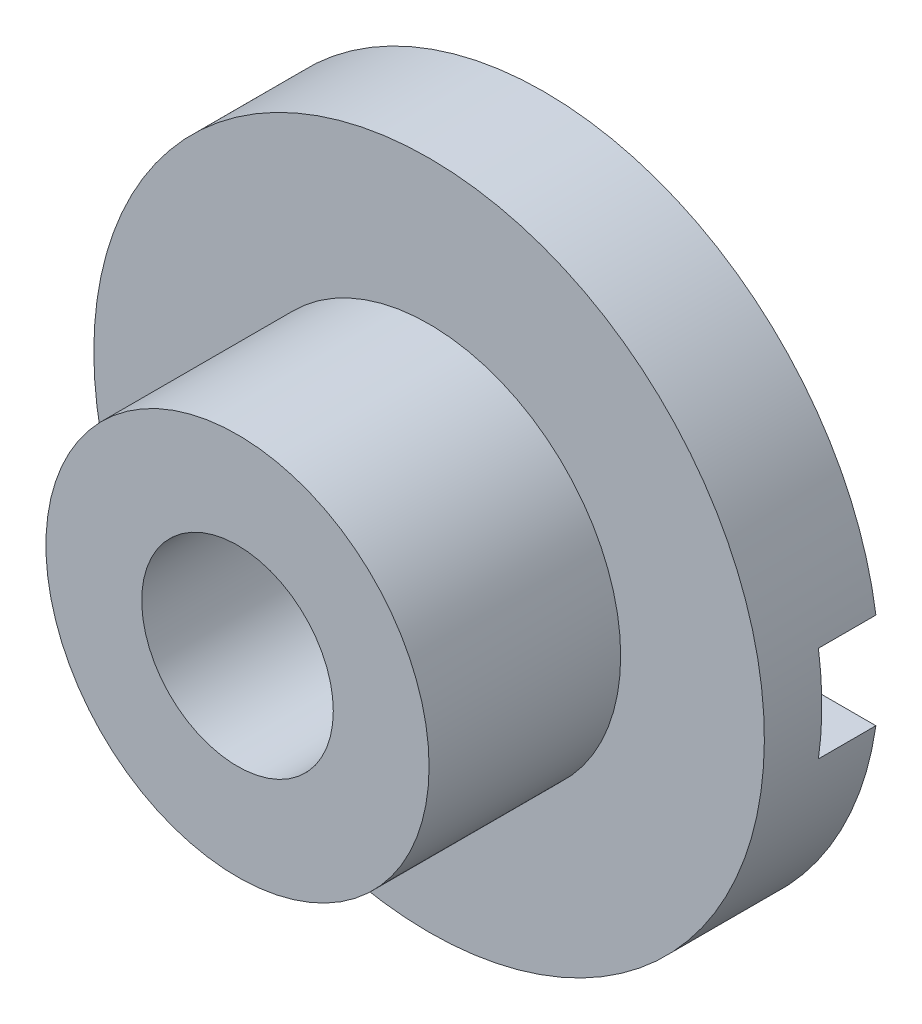
from build123d import *

# Parameters (mm, degrees)
SKETCH1_R           = 7
SKETCH1_R_2         = 3.5
BOSS_EXTRUDE1_DEPTH = 7
SKETCH2_R           = 12.25
BOSS_EXTRUDE2_DEPTH = 4.2
CUT_EXTRUDE1_START  = -2.1
CUT_EXTRUDE1_DEPTH  = 2.1
CUT_EXTRUDE2_START  = -2.1
SKETCH4_R           = 3.5
CUT_EXTRUDE2_DEPTH  = 2.1


with BuildPart() as part:
    # Sketch1 → Boss-Extrude1 (new body)
    with BuildSketch(Plane.XY):
        Circle(SKETCH1_R)
        Circle(SKETCH1_R_2, mode=Mode.SUBTRACT)
    extrude(amount=BOSS_EXTRUDE1_DEPTH)

    # Sketch2 → Boss-Extrude2 (add)
    with BuildSketch(Plane(origin=(0, 0, 0), x_dir=(-1, 0, 0), z_dir=(0, 0, -1))):
        Circle(SKETCH2_R)
    extrude(amount=BOSS_EXTRUDE2_DEPTH)

    # Sketch3 → Cut-Extrude1 (cut)
    with BuildSketch(Plane(origin=(0, 0, -4.2), x_dir=(-1, 0, 0), z_dir=(0, 0, -1)).offset(CUT_EXTRUDE1_START)):
        with BuildLine():
            Line((-12.124355653, 1.75), (12.124355653, 1.75))
            ThreePointArc((12.124355653, 1.75), (12.25, 0), (12.124355653, -1.75))
            Line((12.124355653, -1.75), (-12.124355653, -1.75))
            ThreePointArc((-12.124355653, -1.75), (-12.25, 0), (-12.124355653, 1.75))
        make_face()
    extrude(amount=CUT_EXTRUDE1_DEPTH, mode=Mode.SUBTRACT)

    # Sketch4 → Cut-Extrude2 (cut)
    with BuildSketch(Plane.XY.offset(CUT_EXTRUDE2_START)):
        with Locations(Location((0, 0, 0), (0, 0, 210))):
            Circle(SKETCH4_R)
    extrude(amount=CUT_EXTRUDE2_DEPTH, mode=Mode.SUBTRACT)


solid = part.part
